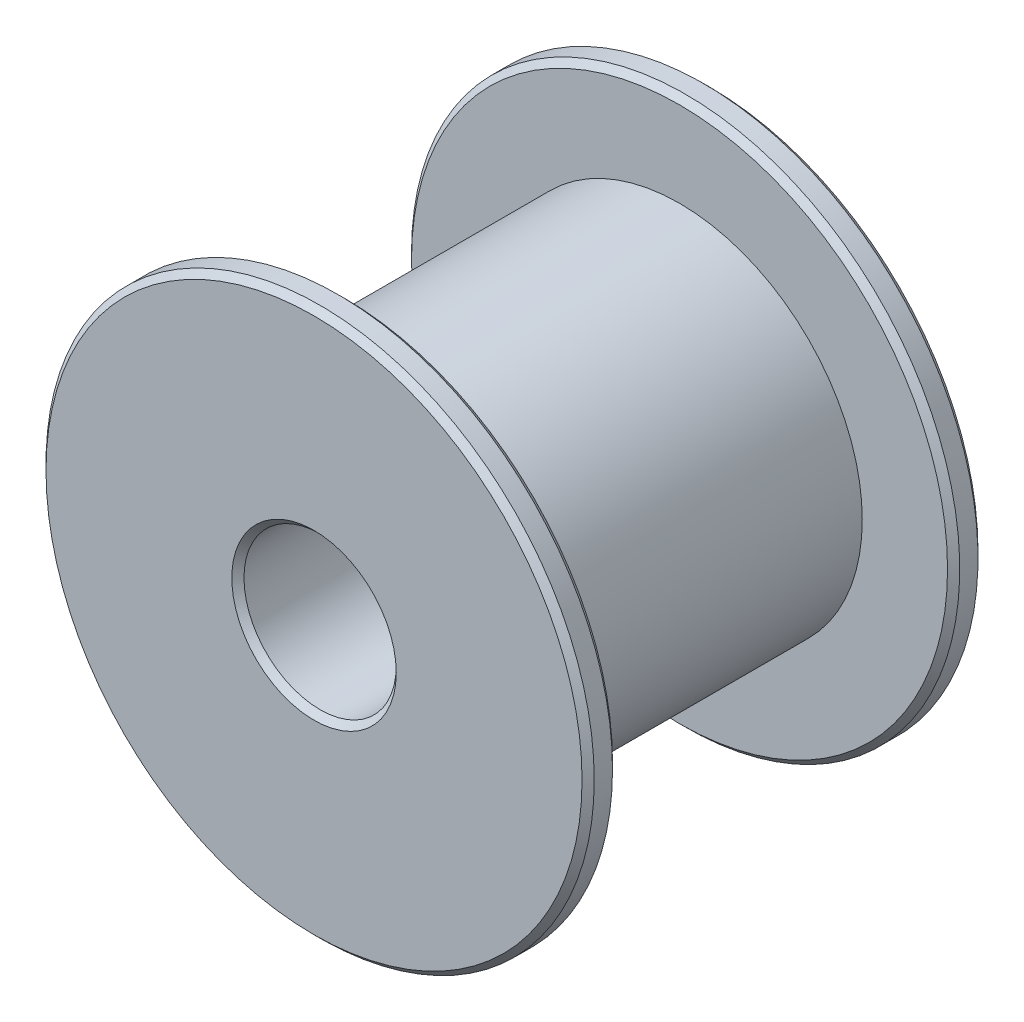
from build123d import *

# Parameters (mm, degrees)
SKIZZE1_R                       = 6
AUFSATZ_LINEAR_AUSTRAGEN1_DEPTH = 5.5
SKIZZE2_R                       = 9
AUFSATZ_LINEAR_AUSTRAGEN2_DEPTH = 1
SKIZZE3_R                       = 2.5
SCHNITT_LINEAR_AUSTRAGEN1_DEPTH = 19.193405399
FASE1_SIZE                      = 0.2


with BuildPart() as part:
    # Skizze1 → Aufsatz-Linear austragen1 (new, symmetric)
    with BuildSketch(Plane.XY):
        Circle(SKIZZE1_R)
    extrude(amount=AUFSATZ_LINEAR_AUSTRAGEN1_DEPTH, both=True)

    # Skizze2 → Aufsatz-Linear austragen2 (add)
    with BuildSketch(Plane.XY.offset(5.5)):
        Circle(SKIZZE2_R)
    aufsatz_linear_austragen2 = extrude(amount=AUFSATZ_LINEAR_AUSTRAGEN2_DEPTH)

    # Spiegeln1: Aufsatz-Linear austragen2 across plane
    add(aufsatz_linear_austragen2.mirror(Plane.XY))

    # Skizze3 → Schnitt-Linear austragen1 (cut, through all)
    with BuildSketch(Plane(origin=(0, 0, -6.5), x_dir=(-1, 0, 0), z_dir=(0, 0, -1))):
        Circle(SKIZZE3_R)
    extrude(amount=-SCHNITT_LINEAR_AUSTRAGEN1_DEPTH, mode=Mode.SUBTRACT)

    # Fase1
    fase1_edges = [part.edges().sort_by_distance(p)[0] for p in [
        (-9, 0, -5.5),
        (2.5, 0, 6.5),
        (2.5, 0, -6.5),
        (-9, 0, 5.5),
        (-9, 0, 6.5),
        (-9, 0, -6.5),
    ]]
    chamfer(fase1_edges, length=FASE1_SIZE)


solid = part.part
